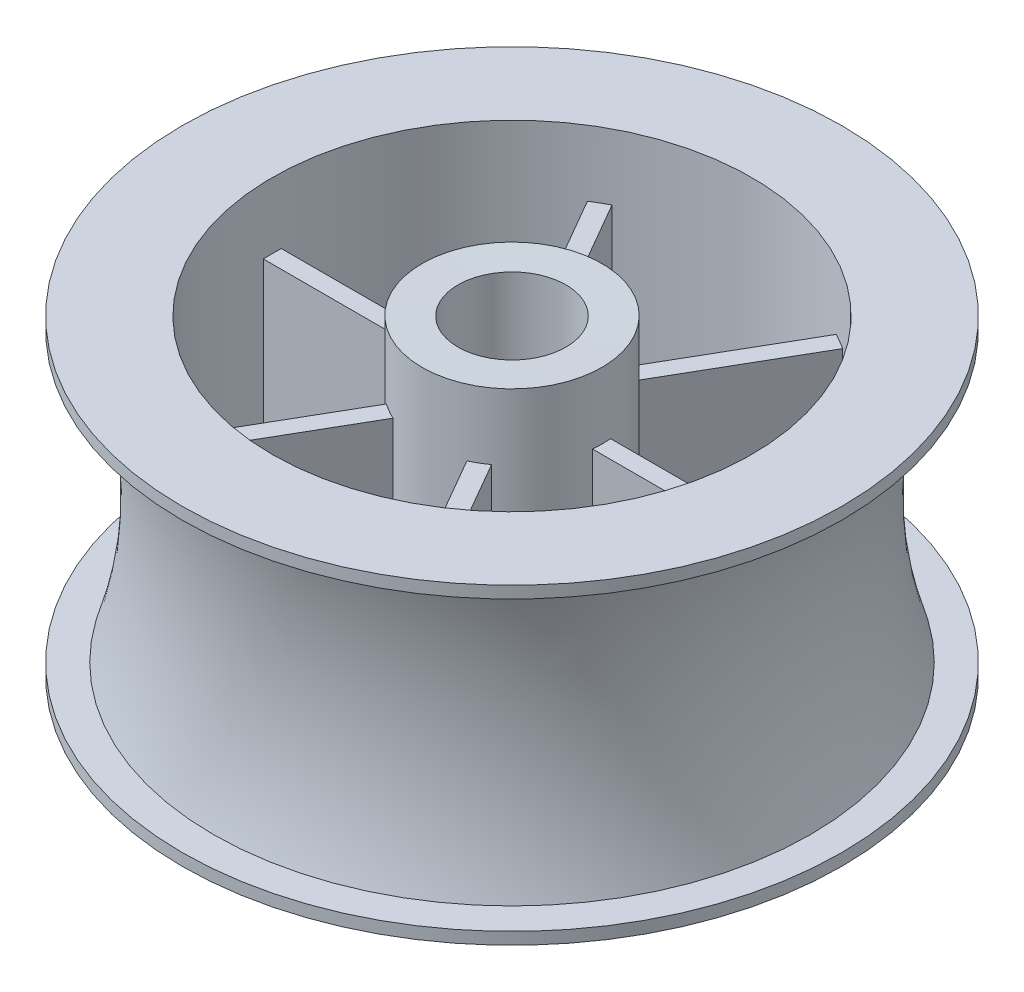
from build123d import *

# Parameters (mm, degrees)
BOSS_EXTRUDE1_START = 5.5
SKETCH4_W           = 13.614691885
SKETCH4_H           = 1.5
BOSS_EXTRUDE1_DEPTH = 15


with BuildPart() as part:
    # Sketch1 → Revolve1 (revolve)
    with BuildSketch(Plane.XY, mode=Mode.PRIVATE) as revolve1_sk:
        with BuildLine():
            Line((-20, 26), (-27.5, 26))
            Line((-27.5, 26), (-27.5, 25))
            Line((-27.5, 25), (-24.9, 25))
            ThreePointArc((-24.9, 25), (-23.057568057, 13), (-24.9, 1))
            Line((-24.9, 1), (-27.5, 1))
            Line((-27.5, 1), (-27.5, 0))
            Line((-27.5, 0), (-20, 0))
            Line((-20, 0), (-20, 5.5))
            Line((-20, 5.5), (-20, 20.5))
            Line((-20, 20.5), (-20, 26))
        make_face()
        Polygon((-4.5, 26), (-4.5, 0), (-7.5, 0), (-7.5, 5.5), (-7.5, 20.5), (-7.5, 26.037065381), align=None)
    revolve(revolve1_sk.sketch.rotate(Axis((0, 42.404735677, 0), (0, -1, 0)), 270), axis=Axis((0, 42.404735677, 0), (0, -1, 0)))

    # Sketch4 → Boss-Extrude1 (add)
    with BuildSketch(Plane(origin=(0, 0, 0), x_dir=(1, 0, 0), z_dir=(0, 1, 0)).offset(BOSS_EXTRUDE1_START)):
        with Locations((13.641384633, 0)):
            Rectangle(SKETCH4_W, SKETCH4_H)
        Polygon((4.066538398, -5.543451116), (10.873884341, -17.334120153), (9.574846235, -18.084120153), (2.767500292, -6.293451116), align=None)
        Polygon((-2.767500292, -6.293451116), (-9.574846235, -18.084120153), (-10.873884341, -17.334120153), (-4.066538398, -5.543451116), align=None)
        with Locations((-13.641384633, 0)):
            Rectangle(SKETCH4_W, SKETCH4_H)
        Polygon((-4.066538398, 5.543451116), (-10.873884341, 17.334120153), (-9.574846235, 18.084120153), (-2.767500292, 6.293451116), align=None)
        Polygon((2.767500292, 6.293451116), (9.574846235, 18.084120153), (10.873884341, 17.334120153), (4.066538398, 5.543451116), align=None)
    extrude(amount=BOSS_EXTRUDE1_DEPTH)


solid = part.part
